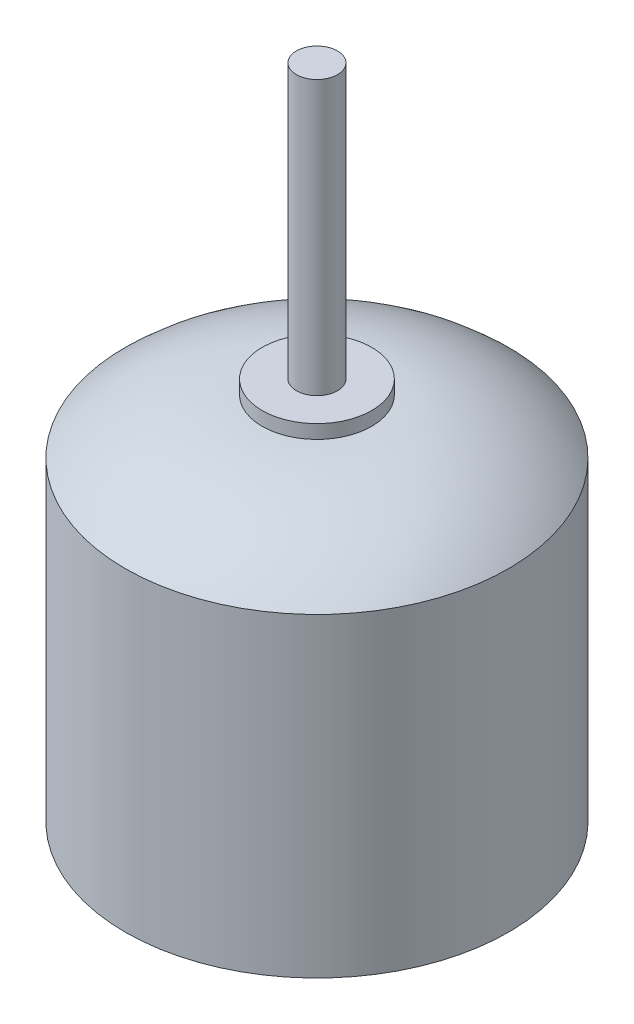
from build123d import *

# Parameters (mm, degrees)
SKETCH1_R           = 14
BOSS_EXTRUDE1_DEPTH = 28
SKETCH2_R           = 1.5
CUT_EXTRUDE1_DEPTH  = 4
SKETCH5_R           = 1.5
BOSS_EXTRUDE2_DEPTH = 20


with BuildPart() as part:
    # Sketch1 → Boss-Extrude1 (new body)
    with BuildSketch(Plane(origin=(0, 0, 0), x_dir=(1, 0, 0), z_dir=(0, 1, 0))):
        with Locations(Location((0, 0, 0), (0, 0, 270))):
            Circle(SKETCH1_R)
    extrude(amount=BOSS_EXTRUDE1_DEPTH)

    # Sketch2 → Cut-Extrude1 (cut)
    with BuildSketch(Plane.XZ):
        with Locations(Location((0, 8, 0), (0, 0, 270))):
            Circle(SKETCH2_R)
        with Locations(Location((9.5, 0, 0), (0, 0, 270))):
            Circle(SKETCH2_R)
        with Locations(Location((0, -8, 0), (0, 0, 270))):
            Circle(SKETCH2_R)
        with Locations(Location((-9.5, 0, 0), (0, 0, 270))):
            Circle(SKETCH2_R)
    extrude(amount=-CUT_EXTRUDE1_DEPTH, mode=Mode.SUBTRACT)

    # Sketch4 → Cut-Revolve1 (revolve, cut)
    with BuildSketch(Plane.XY, mode=Mode.PRIVATE) as cut_revolve1_sk:
        with BuildLine():
            Line((-14, 23), (-14, 28))
            Line((-14, 28), (-4, 28))
            Line((-4, 28), (-4, 27))
            ThreePointArc((-4, 27), (-9.385164807, 25.962912018), (-14, 23))
        make_face()
    revolve(cut_revolve1_sk.sketch.rotate(Axis((0, 28, 0), (0, -1, 0)), 270), axis=Axis((0, 28, 0), (0, -1, 0)), mode=Mode.SUBTRACT)

    # Sketch5 → Boss-Extrude2 (add)
    with BuildSketch(Plane(origin=(0, 28, 0), x_dir=(1, 0, 0), z_dir=(0, 1, 0))):
        with Locations(Location((0, 0, 0), (0, 0, 270))):
            Circle(SKETCH5_R)
    extrude(amount=BOSS_EXTRUDE2_DEPTH)


solid = part.part
